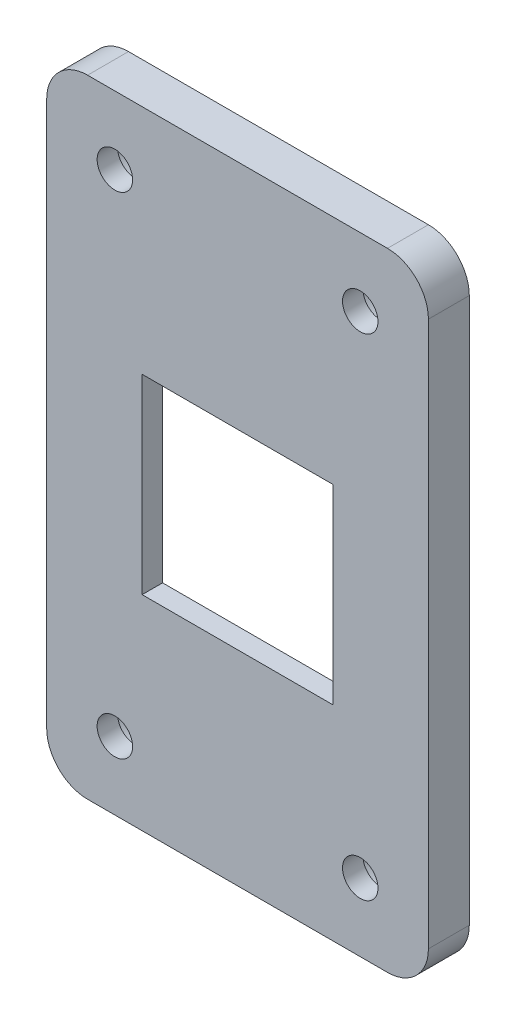
from build123d import *

# Parameters (mm, degrees)
SKETCH2_W                  = 46
SKETCH2_H                  = 28
SKETCH2_W_2                = 14
SKETCH2_H_2                = 14
BOSS_EXTRUDE1_DEPTH        = 3
F_2_6_2_6_DIAMETER_HOLE1_D = 2.6
SKETCH2_6_W                = 20
SKETCH2_6_H                = 20
SKETCH2_6_R                = 2.5
CUT_EXTRUDE2_DEPTH         = 1.5
FILLET1_R                  = 3
CUT_EXTRUDE3_DEPTH         = 0.4


with BuildPart() as part:
    # Sketch2 → Boss-Extrude1 (new body)
    with BuildSketch(Plane(origin=(0, 0, 0), x_dir=(0, 1, 0), z_dir=(0, 0, 1))):
        Rectangle(SKETCH2_W, SKETCH2_H)
        with Locations((-1, 0)):
            Rectangle(SKETCH2_W_2, SKETCH2_H_2, mode=Mode.SUBTRACT)
    extrude(amount=BOSS_EXTRUDE1_DEPTH)

    # Ø2.6 (2.6) Diameter Hole1 (through all)
    with Locations(Plane(origin=(0, 0, 0), x_dir=(-1, 0, 0), z_dir=(0, 0, -1))):
        with Locations((-9, -18), (9, -18), (-9, 18), (9, 18)):
            Hole(F_2_6_2_6_DIAMETER_HOLE1_D / 2)

    # Sketch2<6> → Cut-Extrude2 (cut)
    with BuildSketch(Plane(origin=(0, 0, 0), x_dir=(0, 1, 0), z_dir=(0, 0, 1))):
        with Locations((-1, 0)):
            Rectangle(SKETCH2_6_W, SKETCH2_6_H)
        with Locations((-18, 9)):
            Circle(SKETCH2_6_R)
        with Locations((18, 9)):
            Circle(SKETCH2_6_R)
        with Locations((18, -9)):
            Circle(SKETCH2_6_R)
        with Locations((-18, -9)):
            Circle(SKETCH2_6_R)
    extrude(amount=CUT_EXTRUDE2_DEPTH, mode=Mode.SUBTRACT)

    # Fillet1
    fillet1_edges = [part.edges().sort_by_distance(p)[0] for p in [
        (14, 23, 1.5),
        (14, -23, 1.5),
        (-14, -23, 1.5),
        (-14, 23, 1.5),
    ]]
    fillet(fillet1_edges, radius=FILLET1_R)

    # Sketch6 → Cut-Extrude3 (cut)
    with BuildSketch(Plane(origin=(0, 0, 0), x_dir=(1, 0, 0), z_dir=(0, 0, -1))):
        with BuildLine():
            Line((0.5, 15), (0.5, 13))
            ThreePointArc((0.5, 13), (0, 12.5), (-0.5, 13))
            Line((-0.5, 13), (-0.5, 15))
            ThreePointArc((-0.5, 15), (0, 15.5), (0.5, 15))
        make_face()
    extrude(amount=-CUT_EXTRUDE3_DEPTH, mode=Mode.SUBTRACT)


solid = part.part
